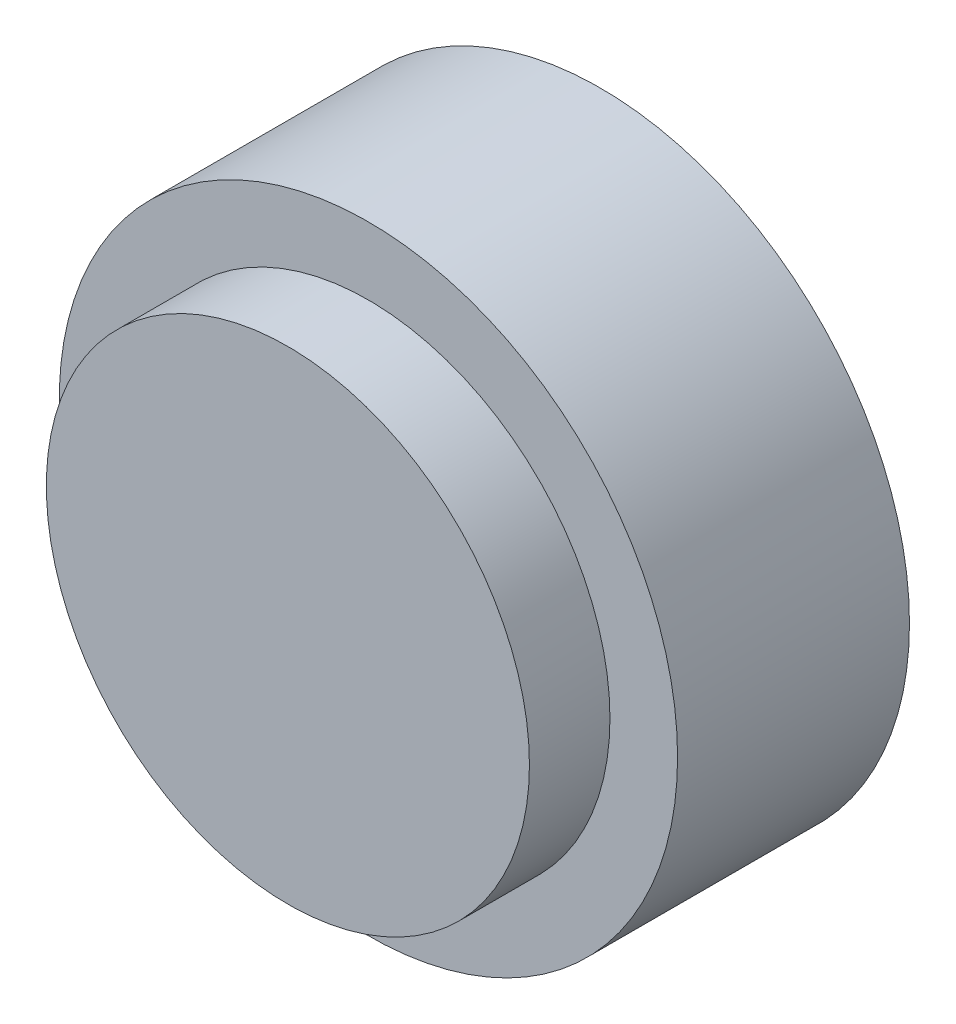
from build123d import *

# Parameters (mm, degrees)
SKETCH1_R                   = 37.5
BOSS_EXTRUDE1_DEPTH         = 12.5
SKETCH1_3_R                 = 48
SKETCH1_3_R_2               = 21
BOSS_EXTRUDE2_DEPTH         = 36
M4_TAPPED_HOLE1_D           = 3.3
M4_TAPPED_HOLE1_DEPTH       = 5.6
M4_TAPPED_HOLE1_CSINK_D     = 4.05
M4_TAPPED_HOLE1_CSINK_ANGLE = 90
M4_TAPPED_HOLE1_TIP         = 0.991420021


with BuildPart() as part:
    # Sketch1 → Boss-Extrude1 (new body)
    with BuildSketch(Plane.XY):
        Circle(SKETCH1_R)
    extrude(amount=BOSS_EXTRUDE1_DEPTH)

    # Sketch1<3> → Boss-Extrude2 (add)
    with BuildSketch(Plane.XY):
        Circle(SKETCH1_3_R)
        Circle(SKETCH1_3_R_2, mode=Mode.SUBTRACT)
    extrude(amount=-BOSS_EXTRUDE2_DEPTH)

    # M4 Tapped Hole1
    with Locations(Plane(origin=(0, 0, -36), x_dir=(-1, 0, 0), z_dir=(0, 0, -1))):
        with Locations((0, 42), (29.69848481, 29.69848481), (42, 0), (29.69848481, -29.69848481), (0, -42), (-29.69848481, -29.69848481), (-42, 0), (-29.69848481, 29.69848481)):
            CounterSinkHole(M4_TAPPED_HOLE1_D / 2, M4_TAPPED_HOLE1_CSINK_D / 2, depth=M4_TAPPED_HOLE1_DEPTH, counter_sink_angle=M4_TAPPED_HOLE1_CSINK_ANGLE)
            with Locations((0, 0, -(M4_TAPPED_HOLE1_DEPTH + M4_TAPPED_HOLE1_TIP / 2))):  # 118° drill point
                Cone(0, M4_TAPPED_HOLE1_D / 2, M4_TAPPED_HOLE1_TIP, mode=Mode.SUBTRACT)


solid = part.part
